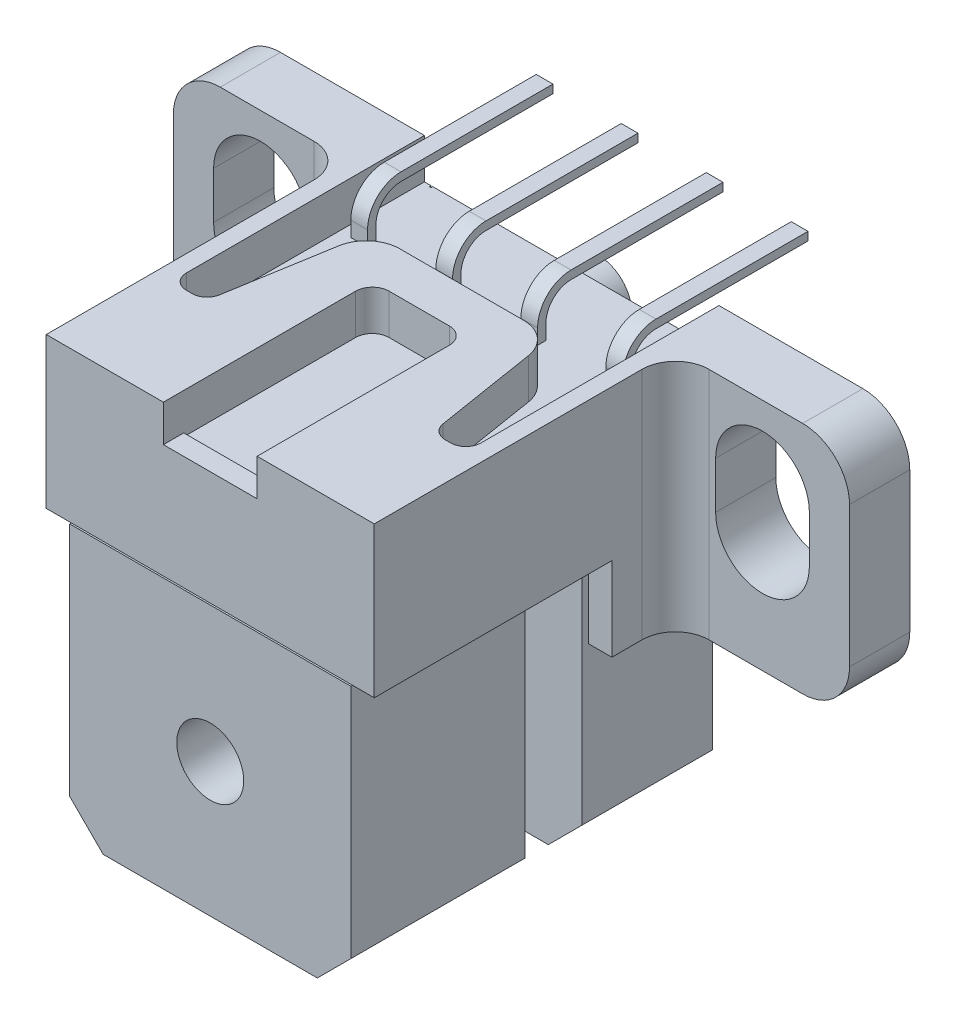
from build123d import *

# Parameters (mm, degrees)
EXTRUDE_1_DEPTH      = 10.8
SKETCH_2_R           = 1
EXTRUDE_2_DEPTH      = 0.8
SKETCH_3_W           = 1.7
SKETCH_3_H           = 8.1
CUT_EXTRUDE_1_DEPTH  = 17.8
EXTRUDE_START        = -4.5
EXTRUDE_3_DEPTH      = 4.5
SKETCH_5_W           = 8.4
SKETCH_5_H           = 0.05
CUT_EXTRUDE_2_DEPTH  = 1
SKETCH_6_R           = 1
CUT_EXTRUDE_3_DEPTH  = 8
CUT_EXTRUDE_4_DEPTH  = 1.2
SKETCH_8_W           = 2.8
SKETCH_8_H           = 0.608363533
EXTRUDE_4_DEPTH      = 0.1
EXTRUDE_START_2      = 2.5
EXTRUDE_5_DEPTH      = 2.5
SKETCH_10_W          = 8.4
SKETCH_10_H          = 1.7
CUT_EXTRUDE_5_DEPTH  = 0.05
FILLET_1_R           = 1.4
SKETCH_11_W          = 0.05
SKETCH_11_H          = 5.83834946
SKETCH_11_H_2        = 5.828769054
CUT_EXTRUDE_8_DEPTH  = 0.05
CUT_EXTRUDE_9_DEPTH  = 4
SKETCH_13_W          = 0.5
SKETCH_13_H          = 5.54
EXTRUDE_6_DEPTH      = 1.45
FILLET_2_R           = 1
CUT_EXTRUDE_START    = -8.12
CUT_EXTRUDE_10_DEPTH = 8.12


with BuildPart() as part:
    # Эскиз1 → Бобышка-Вытянуть1 (new body)
    with BuildSketch(Plane.XY):
        Polygon((7.4, 0), (8.4, 1), (8.4, 12.6), (0, 12.6), (0, 1), (1, 0), align=None)
    extrude(amount=EXTRUDE_1_DEPTH)

    # Эскиз2 → Бобышка-Вытянуть2 (add)
    with BuildSketch(Plane(origin=(0, 0, 0), x_dir=(-1, 0, 0), z_dir=(0, 0, -1))):
        with Locations((-4.2, 10.3)):
            Circle(SKETCH_2_R)
        with Locations((-4.2, 3.9)):
            Circle(SKETCH_2_R)
    extrude(amount=EXTRUDE_2_DEPTH)

    # Эскиз3 → Вырез-Вытянуть1 (cut)
    with BuildSketch(Plane(origin=(8.4, 0, 0), x_dir=(0, 0, -1), z_dir=(1, 0, 0))):
        with Locations((-4.75, 4.05)):
            Rectangle(SKETCH_3_W, SKETCH_3_H)
    extrude(amount=-CUT_EXTRUDE_1_DEPTH, mode=Mode.SUBTRACT)

    # Эскиз4 → Бобышка-Вытянуть3 (add)
    with BuildSketch(Plane(origin=(0, 12.6, 0), x_dir=(1, 0, 0), z_dir=(0, 1, 0)).offset(EXTRUDE_START)):
        with BuildLine():
            Line((9.1, -10.8), (-0.7, -10.8))
            Line((-0.7, -10.8), (-0.7, -2.8))
            ThreePointArc((-0.7, -2.8), (-0.992893219, -2.092893219), (-1.7, -1.8))
            Line((-1.7, -1.8), (-5.9, -1.8))
            Line((-5.9, -1.8), (-5.9, 0))
            Line((-5.9, 0), (14.3, 0))
            Line((14.3, 0), (14.3, -1.8))
            Line((14.3, -1.8), (10.1, -1.8))
            ThreePointArc((10.1, -1.8), (9.392893219, -2.092893219), (9.1, -2.8))
            Line((9.1, -2.8), (9.1, -10.8))
        make_face()
    extrude(amount=EXTRUDE_3_DEPTH)

    # Эскиз5 → Вырез-Вытянуть2 (cut)
    with BuildSketch(Plane.XY.offset(10.8)):
        with Locations((4.2, 8.075)):
            Rectangle(SKETCH_5_W, SKETCH_5_H)
    extrude(amount=-CUT_EXTRUDE_2_DEPTH, mode=Mode.SUBTRACT)

    # Эскиз6 → Вырез-Вытянуть3 (cut)
    with BuildSketch(Plane.XY.offset(10.8)):
        with Locations((4.2, 4)):
            Circle(SKETCH_6_R)
    extrude(amount=-CUT_EXTRUDE_3_DEPTH, mode=Mode.SUBTRACT)

    # Эскиз7 → Вырез-Вытянуть4 (cut)
    with BuildSketch(Plane(origin=(0, 12.6, 0), x_dir=(1, 0, 0), z_dir=(0, 1, 0))):
        with BuildLine():
            Line((8.6, 0), (8.6, -7.112411136))
            ThreePointArc((8.6, -7.112411136), (8.468198052, -7.430609188), (8.15, -7.562411136))
            Line((8.15, -7.562411136), (7.983405928, -7.562411136))
            ThreePointArc((7.983405928, -7.562411136), (7.691564003, -7.454943311), (7.539115931, -7.183870205))
            Line((7.539115931, -7.183870205), (7.049736844, -4.141202068))
            ThreePointArc((7.049736844, -4.141202068), (6.710963351, -3.53881739), (6.062425739, -3.3))
            Line((6.062425739, -3.3), (2.361664993, -3.3))
            ThreePointArc((2.361664993, -3.3), (1.71573807, -3.536600753), (1.37546474, -4.13444318))
            Line((1.37546474, -4.13444318), (0.863036378, -7.186911705))
            ThreePointArc((0.863036378, -7.186911705), (0.709913379, -7.455940797), (0.419246264, -7.562411136))
            Line((0.419246264, -7.562411136), (0.25, -7.562411136))
            ThreePointArc((0.25, -7.562411136), (-0.068198052, -7.430609188), (-0.2, -7.112411136))
            Line((-0.2, -7.112411136), (-0.2, 0))
            Line((-0.2, 0), (8.6, 0))
        make_face()
        with BuildLine():
            Line((4.2, -10.8), (5.6, -10.8))
            Line((5.6, -10.8), (5.6, -5.056380156))
            ThreePointArc((5.6, -5.056380156), (5.453553391, -4.702826765), (5.1, -4.556380156))
            Line((5.1, -4.556380156), (3.3, -4.556380156))
            ThreePointArc((3.3, -4.556380156), (2.946446609, -4.702826765), (2.8, -5.056380156))
            Line((2.8, -5.056380156), (2.8, -10.8))
            Line((2.8, -10.8), (4.2, -10.8))
        make_face()
    extrude(amount=-CUT_EXTRUDE_4_DEPTH, mode=Mode.SUBTRACT)

    # Эскиз8 → Бобышка-Вытянуть4 (add)
    with BuildSketch(Plane(origin=(0, 11.4, 0), x_dir=(1, 0, 0), z_dir=(0, 1, 0))):
        with Locations((4.2, -10.495818233)):
            Rectangle(SKETCH_8_W, SKETCH_8_H)
    extrude(amount=EXTRUDE_4_DEPTH)

    # Эскиз9 → Бобышка-Вытянуть5 (add)
    with BuildSketch(Plane.XZ.offset(-8.1).offset(EXTRUDE_START_2)):
        with BuildLine():
            Line((0, 0), (0, 3.7))
            Line((0, 3.7), (-0.7, 3.7))
            Line((-0.7, 3.7), (-0.7, 2.8))
            ThreePointArc((-0.7, 2.8), (-0.992893219, 2.092893219), (-1.7, 1.8))
            Line((-1.7, 1.8), (-5.9, 1.8))
            Line((-5.9, 1.8), (-5.9, 0))
            Line((-5.9, 0), (0, 0))
        make_face()
        with BuildLine():
            Line((14.3, 0), (8.4, 0))
            Line((8.4, 0), (8.4, 3.7))
            Line((8.4, 3.7), (9.1, 3.7))
            Line((9.1, 3.7), (9.1, 2.8))
            ThreePointArc((9.1, 2.8), (9.392893219, 2.092893219), (10.1, 1.8))
            Line((10.1, 1.8), (14.3, 1.8))
            Line((14.3, 1.8), (14.3, 0))
        make_face()
    extrude(amount=-EXTRUDE_5_DEPTH)

    # Эскиз10 → Вырез-Вытянуть5 (cut)
    with BuildSketch(Plane.XZ.offset(-8.1)):
        with Locations((4.2, 4.75)):
            Rectangle(SKETCH_10_W, SKETCH_10_H)
    extrude(amount=-CUT_EXTRUDE_5_DEPTH, mode=Mode.SUBTRACT)

    # Скругление1
    fillet_1_edges = [part.edges().sort_by_distance(p)[0] for p in [
        (-5.9, 5.6, 0.9),
        (14.3, 5.6, 0.9),
        (14.3, 12.6, 0.9),
        (-5.9, 12.6, 0.9),
    ]]
    fillet(fillet_1_edges, radius=FILLET_1_R)

    # Эскиз11 → Вырез-Вытянуть8 (cut)
    with BuildSketch(Plane(origin=(0, 0, 0), x_dir=(-1, 0, 0), z_dir=(0, 0, -1))):
        with Locations((-8.375, 8.48082527)):
            Rectangle(SKETCH_11_W, SKETCH_11_H)
        with Locations((-0.025, 8.485615473)):
            Rectangle(SKETCH_11_W, SKETCH_11_H_2)
    extrude(amount=-CUT_EXTRUDE_8_DEPTH, mode=Mode.SUBTRACT)

    # Эскиз12 → Вырез-Вытянуть9 (cut)
    with BuildSketch(Plane(origin=(0, 0, 0), x_dir=(-1, 0, 0), z_dir=(0, 0, -1))):
        with BuildLine():
            Line((1.9, 9), (1.9, 10.4))
            ThreePointArc((1.9, 10.4), (3.3, 11.8), (4.7, 10.4))
            Line((4.7, 10.4), (4.7, 9))
            ThreePointArc((4.7, 9), (3.3, 7.6), (1.9, 9))
        make_face()
        with BuildLine():
            Line((-10.3, 10.4), (-10.3, 9))
            ThreePointArc((-10.3, 9), (-11.7, 7.6), (-13.1, 9))
            Line((-13.1, 9), (-13.1, 10.4))
            ThreePointArc((-13.1, 10.4), (-11.7, 11.8), (-10.3, 10.4))
        make_face()
    extrude(amount=-CUT_EXTRUDE_9_DEPTH, mode=Mode.SUBTRACT)

    # Эскиз13 → Бобышка-Вытянуть6 (add)
    with BuildSketch(Plane(origin=(0, 11.4, 0), x_dir=(1, 0, 0), z_dir=(0, 1, 0))):
        with Locations((5.47, 0.23)):
            Rectangle(SKETCH_13_W, SKETCH_13_H)
        with Locations((8.01, 0.23)):
            Rectangle(SKETCH_13_W, SKETCH_13_H)
        with Locations((2.93, 0.23)):
            Rectangle(SKETCH_13_W, SKETCH_13_H)
        with Locations((0.39, 0.23)):
            Rectangle(SKETCH_13_W, SKETCH_13_H)
    extrude(amount=EXTRUDE_6_DEPTH)

    # Скругление2
    fillet_2_edges = [part.edges().sort_by_distance(p)[0] for p in [
        (5.47, 12.85, 2.54),
        (2.93, 12.85, 2.54),
        (0.39, 12.85, 2.54),
        (8.01, 12.85, 2.54),
    ]]
    fillet(fillet_2_edges, radius=FILLET_2_R)

    # Эскиз14 → Вырез-Вытянуть10 (cut)
    with BuildSketch(Plane.ZY.offset(-0.14).offset(CUT_EXTRUDE_START)):
        with BuildLine():
            Line((-3, 12.6), (1.54, 12.6))
            ThreePointArc((1.54, 12.6), (2.070330086, 12.380330086), (2.29, 11.85))
            Line((2.29, 11.85), (2.29, 11.4))
            Line((2.29, 11.4), (-3, 11.4))
            Line((-3, 11.4), (-3, 12.6))
        make_face()
    extrude(amount=CUT_EXTRUDE_10_DEPTH, mode=Mode.SUBTRACT)


solid = part.part
